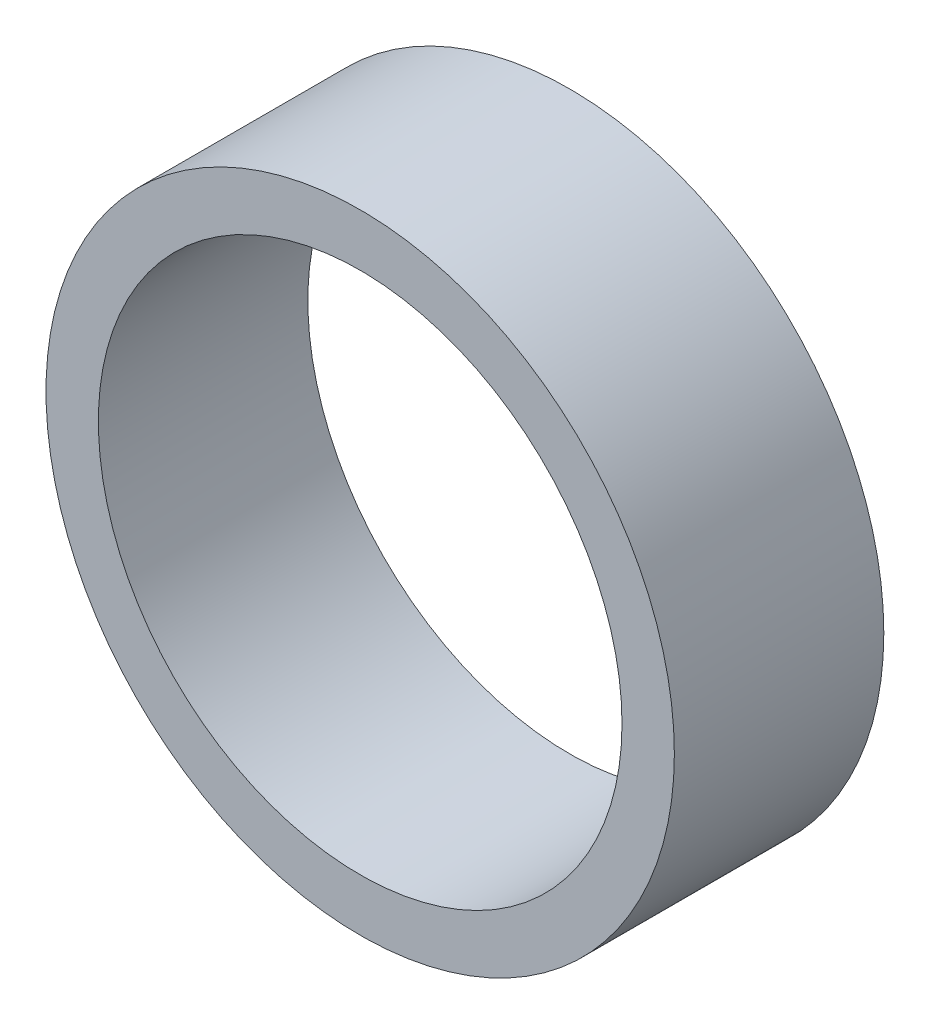
from build123d import *

# Parameters (mm, degrees)
SKETCH_1_R      = 3
SKETCH_1_R_2    = 2.5
EXTRUDE_1_DEPTH = 2


with BuildPart() as part:
    # 草图1 → 凸台-拉伸1 (new body)
    with BuildSketch(Plane.XY):
        Circle(SKETCH_1_R)
        Circle(SKETCH_1_R_2, mode=Mode.SUBTRACT)
    extrude(amount=EXTRUDE_1_DEPTH)


solid = part.part
